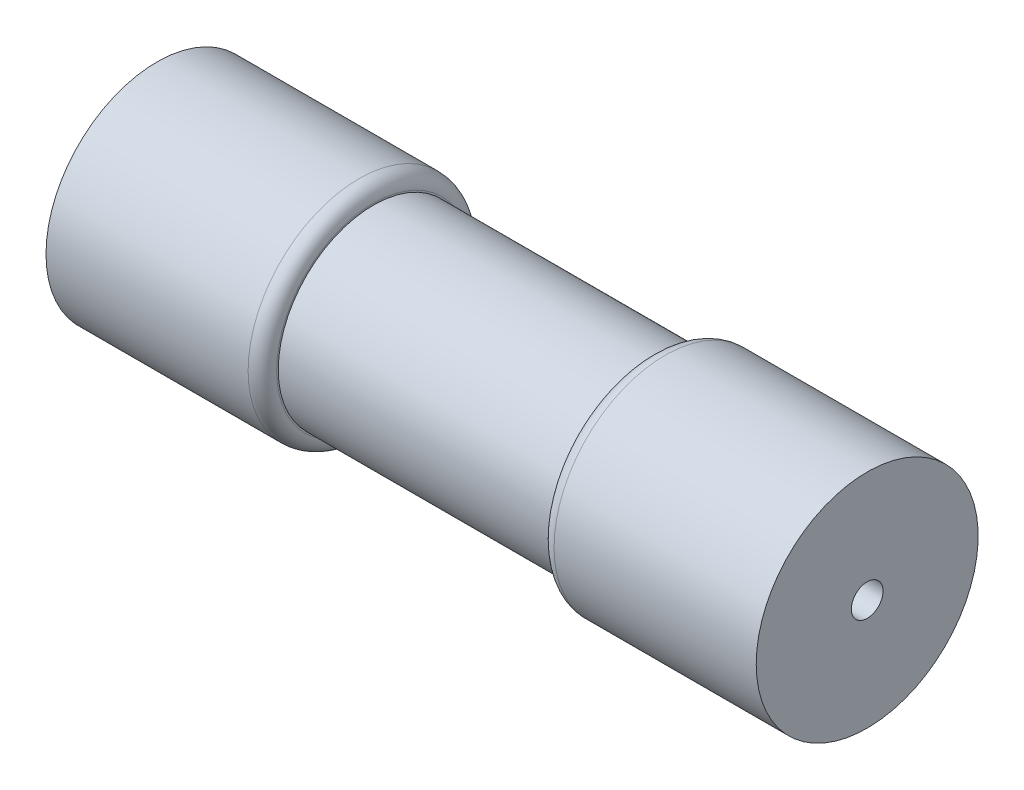
from build123d import *


with BuildPart() as part:
    # Esquisse1 → Révolution1 (revolve)
    with BuildSketch(Plane.XY, mode=Mode.PRIVATE) as r_volution1_sk:
        with BuildLine():
            Line((0, 70), (0, 10))
            Line((0, 10), (448, 10))
            Line((448, 10), (448, 70))
            Line((448, 70), (320.5, 70))
            ThreePointArc((320.5, 70), (314.136038969, 67.363961031), (311.5, 61))
            Line((311.5, 61), (311.5, 60))
            Line((311.5, 60), (136.5, 60))
            Line((136.5, 60), (136.5, 61))
            ThreePointArc((136.5, 61), (133.863961031, 67.363961031), (127.5, 70))
            Line((127.5, 70), (0, 70))
        make_face()
    revolve(r_volution1_sk.sketch.rotate(Axis((0, 0, 0), (1, 0, 0)), 90), axis=Axis((0, 0, 0), (1, 0, 0)))


solid = part.part
